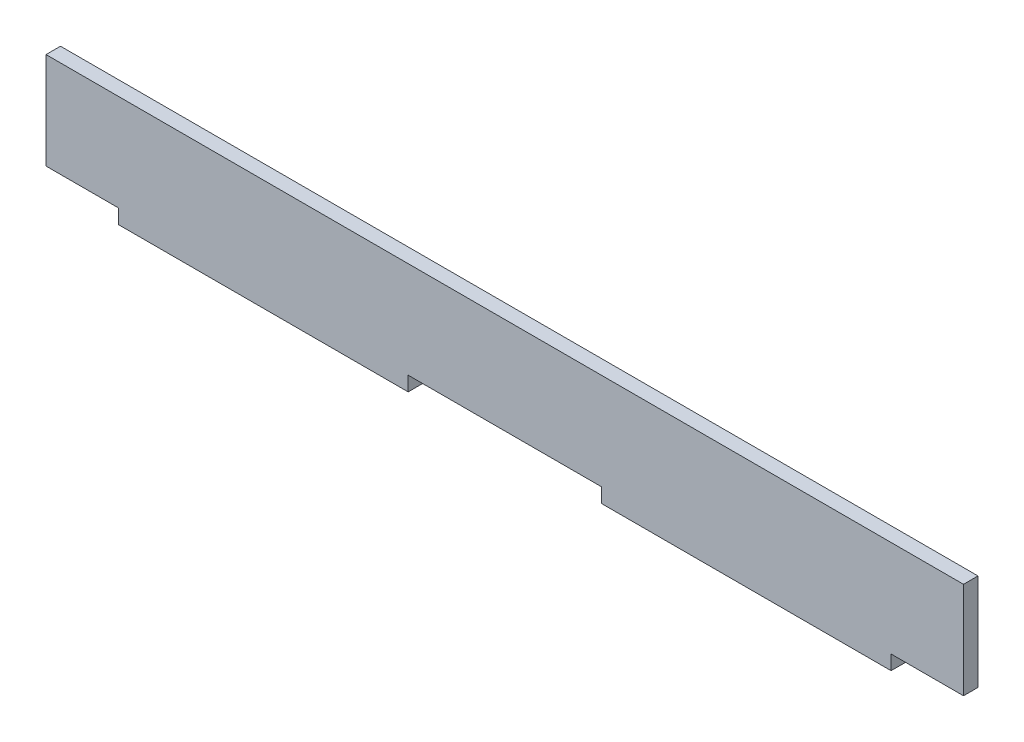
from build123d import *

# Parameters (mm, degrees)
BOSS_EXTRU_1_DEPTH = 3


with BuildPart() as part:
    # Esquisse1 → Boss.-Extru.1 (new body)
    with BuildSketch(Plane.XY):
        Polygon((175, 0), (190, 0), (190, 20), (0, 20), (0, 0), (15, 0), (15, -3), (75, -3), (75, 0), (115, 0), (115, -3), (175, -3), align=None)
    extrude(amount=BOSS_EXTRU_1_DEPTH)


solid = part.part
